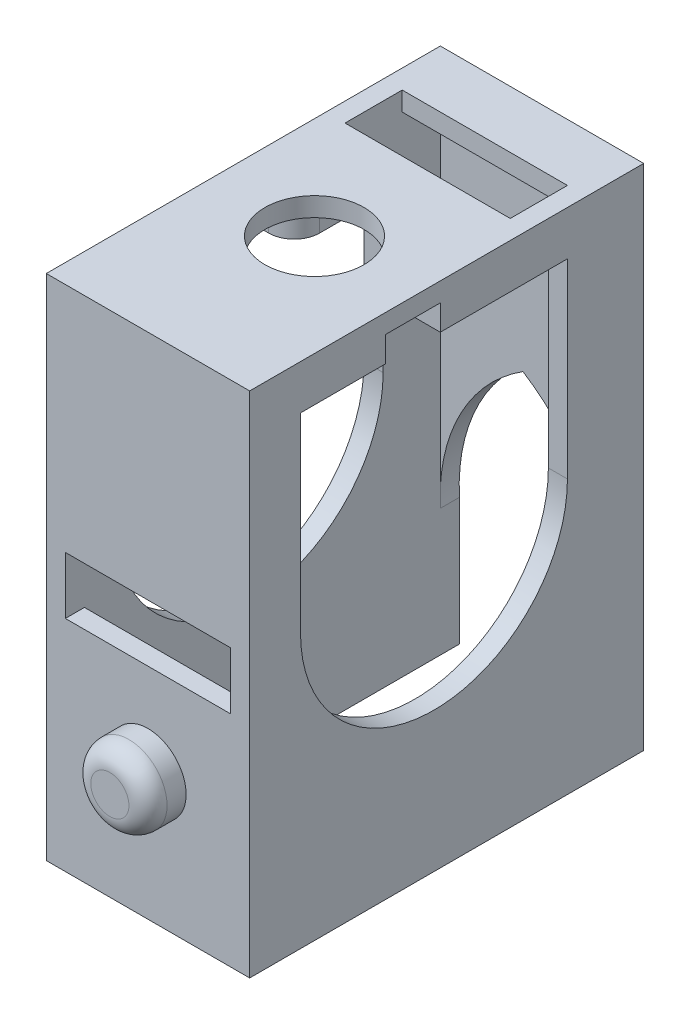
from build123d import *

# Parameters (mm, degrees)
SKETCH1_W           = 16
SKETCH1_H           = 31
BOSS_EXTRUDE1_DEPTH = 40
SHELL1_T            = -1.5
SKETCH2_W           = 13
SKETCH2_H           = 4.5
CUT_EXTRUDE1_DEPTH  = 1.5
CUT_EXTRUDE2_DEPTH  = 1.5
SKETCH4_R           = 3.9
CUT_EXTRUDE3_DEPTH  = 1.5
SKETCH6_W           = 3
SKETCH6_H           = 7
BOSS_EXTRUDE2_DEPTH = 2
SKETCH7_W           = 3.2
SKETCH7_H           = 9.2
BOSS_EXTRUDE3_DEPTH = 2
SKETCH9_W           = 13
SKETCH9_H           = 4.5
CUT_EXTRUDE5_DEPTH  = 1.5
FILLET1_R           = 2
SKETCH10_R          = 3
BOSS_EXTRUDE4_DEPTH = 3
FILLET2_R           = 1.5
CUT_EXTRUDE6_DEPTH  = 55.881690936
SKETCH12_W          = 4.3
SKETCH12_H          = 2
CUT_EXTRUDE7_DEPTH  = 55.881690936


with BuildPart() as part:
    # Sketch1 → Boss-Extrude1 (new body)
    with BuildSketch(Plane(origin=(0, 0, 0), x_dir=(1, 0, 0), z_dir=(0, 1, 0))):
        with Locations((8, -15.5)):
            Rectangle(SKETCH1_W, SKETCH1_H)
    extrude(amount=BOSS_EXTRUDE1_DEPTH)

    # Shell1
    shell1_openings = [part.faces().sort_by_distance(p)[0] for p in [
        (8, 0, 15.5),
    ]]
    offset(amount=SHELL1_T, openings=shell1_openings, kind=Kind.INTERSECTION)

    # Sketch2 → Cut-Extrude1 (cut)
    with BuildSketch(Plane(origin=(0, 40, 0), x_dir=(1, 0, 0), z_dir=(0, 1, 0))):
        with Locations((8, -6.75)):
            Rectangle(SKETCH2_W, SKETCH2_H)
    extrude(amount=-CUT_EXTRUDE1_DEPTH, mode=Mode.SUBTRACT)

    # Sketch3 → Cut-Extrude2 (cut)
    with BuildSketch(Plane(origin=(0, 0, 0), x_dir=(-1, 0, 0), z_dir=(0, 0, -1))):
        with BuildLine():
            Line((-14.5, 10), (-14.5, -1))
            Line((-14.5, -1), (-1.5, -1))
            Line((-1.5, -1), (-1.5, 10))
            ThreePointArc((-1.5, 10), (-3.046805874, 17.164215382), (-8, 22.566479573))
            ThreePointArc((-8, 22.566479573), (-12.953194126, 17.164215382), (-14.5, 10))
        make_face()
    extrude(amount=-CUT_EXTRUDE2_DEPTH, mode=Mode.SUBTRACT)

    # Sketch4 → Cut-Extrude3 (cut)
    with BuildSketch(Plane(origin=(0, 40, 0), x_dir=(1, 0, 0), z_dir=(0, 1, 0))):
        with Locations(Location((8, -17.9, 0), (0, 0, 270))):
            Circle(SKETCH4_R)
    extrude(amount=-CUT_EXTRUDE3_DEPTH, mode=Mode.SUBTRACT)

    # Sketch6 → Boss-Extrude2 (add)
    with BuildSketch(Plane(origin=(0, 38.5, 0), x_dir=(-1, 0, 0), z_dir=(0, -1, 0))):
        with Locations((-13, -12.5)):
            Rectangle(SKETCH6_W, SKETCH6_H)
        with Locations((-3, -12.5)):
            Rectangle(SKETCH6_W, SKETCH6_H)
    extrude(amount=BOSS_EXTRUDE2_DEPTH)

    # Sketch7 → Boss-Extrude3 (add)
    with BuildSketch(Plane(origin=(0, 38.5, 0), x_dir=(-1, 0, 0), z_dir=(0, -1, 0))):
        with Locations((-12.9, -24.9)):
            Rectangle(SKETCH7_W, SKETCH7_H)
        with Locations((-3.1, -24.9)):
            Rectangle(SKETCH7_W, SKETCH7_H)
    extrude(amount=BOSS_EXTRUDE3_DEPTH)

    # Sketch9 → Cut-Extrude5 (cut)
    with BuildSketch(Plane.XY.offset(31)):
        with Locations((8, 19.497097074)):
            Rectangle(SKETCH9_W, SKETCH9_H)
    extrude(amount=-CUT_EXTRUDE5_DEPTH, mode=Mode.SUBTRACT)

    # Fillet1
    fillet1_edges = [part.edges().sort_by_distance(p)[0] for p in [
        (11.3, 37.5, 20.3),
        (4.7, 37.5, 20.3),
        (11.5, 37.5, 16),
        (4.5, 37.5, 16),
    ]]
    fillet(fillet1_edges, radius=FILLET1_R)

    # Sketch10 → Boss-Extrude4 (add)
    with BuildSketch(Plane.XY.offset(31)):
        with Locations((8, 10)):
            Circle(SKETCH10_R)
    extrude(amount=BOSS_EXTRUDE4_DEPTH)

    # Fillet2
    fillet2_edges = [part.edges().sort_by_distance(p)[0] for p in [
        (5, 10, 34),
    ]]
    fillet(fillet2_edges, radius=FILLET2_R)

    # Sketch11 → Cut-Extrude6 (cut, through all)
    with BuildSketch(Plane.ZY):
        with BuildLine():
            Line((6, 36.5), (27, 36.5))
            Line((27, 36.5), (27, 21.5))
            ThreePointArc((27, 21.5), (16.5, 11), (6, 21.5))
            Line((6, 21.5), (6, 36.5))
        make_face()
    extrude(amount=-CUT_EXTRUDE6_DEPTH, mode=Mode.SUBTRACT)

    # Sketch12 → Cut-Extrude7 (cut, through all)
    with BuildSketch(Plane(origin=(16, 0, 0), x_dir=(0, 0, -1), z_dir=(1, 0, 0))):
        with Locations((-18.15, 37.5)):
            Rectangle(SKETCH12_W, SKETCH12_H)
    extrude(amount=-CUT_EXTRUDE7_DEPTH, mode=Mode.SUBTRACT)


solid = part.part
